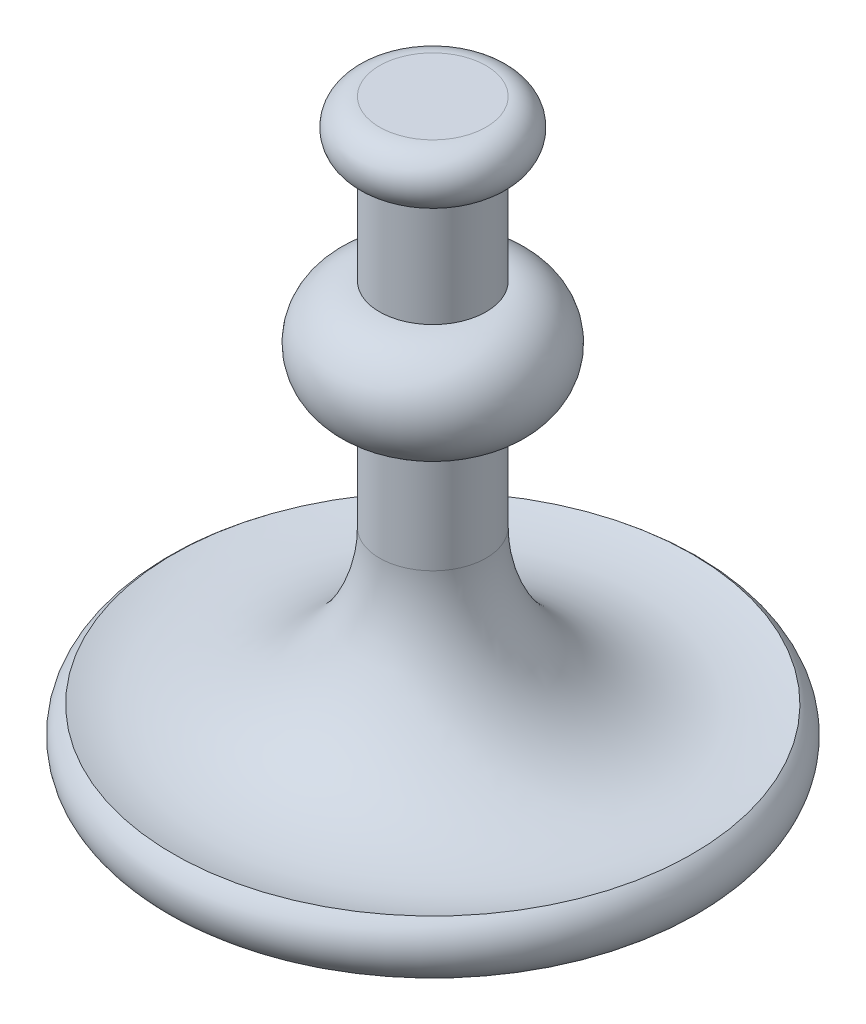
from build123d import *


with BuildPart() as part:
    # Sketch1 → Revolve1 (revolve)
    with BuildSketch(Plane.XY, mode=Mode.PRIVATE) as revolve1_sk:
        with BuildLine():
            Line((0, 0), (-90, 0))
            Line((-90, 0), (-90, 220))
            Line((-90, 220), (-70, 220))
            ThreePointArc((-70, 220), (-60, 210), (-70, 200))
            Line((-70, 200), (-70, 160))
            ThreePointArc((-70, 160), (-50, 140), (-70, 120))
            Line((-70, 120), (-70, 80))
            ThreePointArc((-70, 80), (-45.75081545, 31.814118306), (7.395973154, 22.577181208))
            ThreePointArc((7.395973154, 22.577181208), (11.878862848, 8.608648378), (0, 0))
        make_face()
    revolve(revolve1_sk.sketch.rotate(Axis((-90, 0, 0), (0, 1, 0)), 90), axis=Axis((-90, 0, 0), (0, 1, 0)))


solid = part.part
